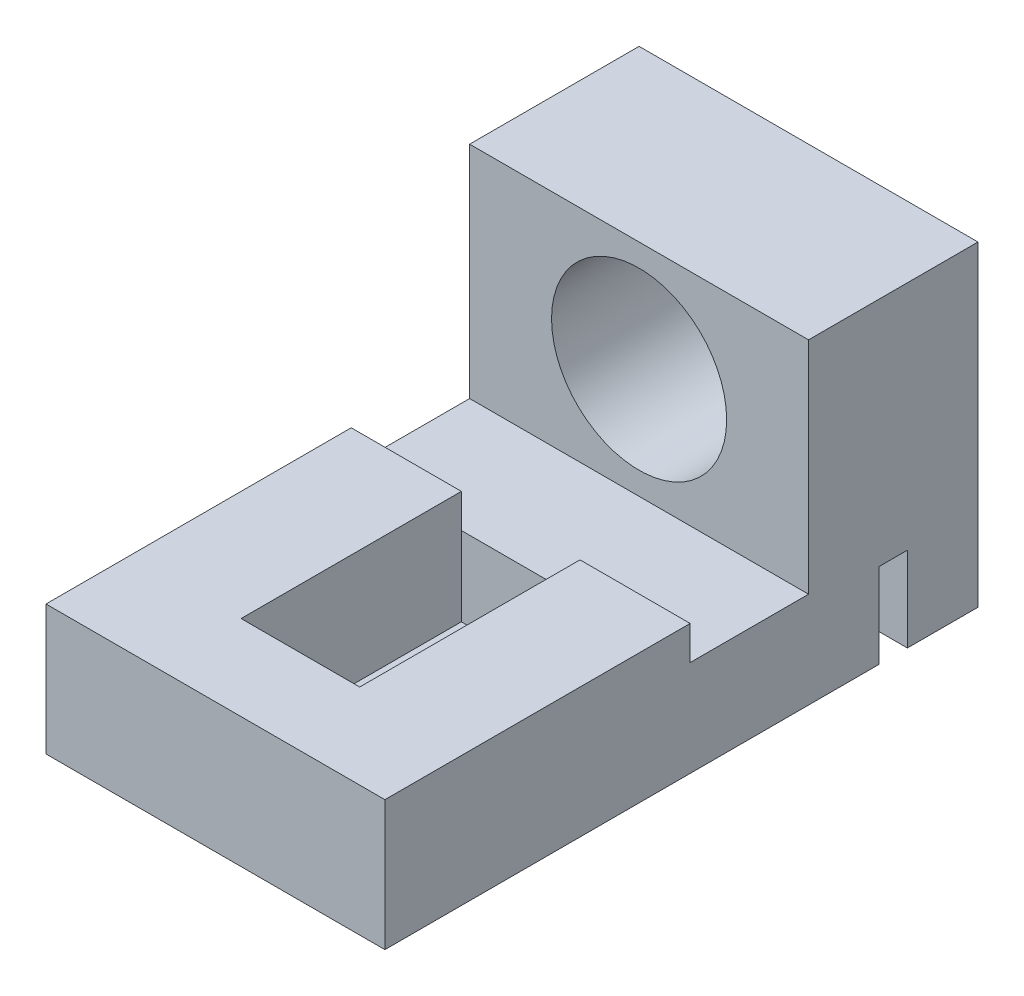
from build123d import *

# Parameters (mm, degrees)
EXTRUDE_1_DEPTH          = 60
CUT_EXTRUDE_1_DEPTH      = 40
CUT_EXTRUDE_1_DEPTH_BACK = 29
SKETCH_4_R               = 15.5
SKETCH_5_W               = 5
SKETCH_5_H               = 30
CUT_EXTRUDE_2_DEPTH      = 83.900874001
SKETCH_7_W               = 60
SKETCH_7_H               = 85.424918669
EXTRUDE_2_DEPTH          = 17
CUT_EXTRUDE_START        = -34.454396
SKETCH_9_W               = 21
SKETCH_9_H               = 39
CUT_EXTRUDE_3_DEPTH      = 14
CUT_EXTRUDE_START_2      = -15
SKETCH_14_W              = 60
SKETCH_14_H              = 56
CUT_EXTRUDE_8_DEPTH      = 10
CUT_EXTRUDE_START_3      = 15
SKETCH_16_W              = 60
SKETCH_16_H              = 39
CUT_EXTRUDE_11_DEPTH     = 10
EXTRUDE_START            = -34.454396
EXTRUDE_5_DEPTH          = 6


with BuildPart() as part:
    # 스케치3 → 보스-돌출1 (new body)
    with BuildSketch(Plane(origin=(0, 0, 0), x_dir=(0, 0, -1), z_dir=(1, 0, 0))):
        Polygon((-25, -51.454396413), (25, -51.454396413), (15, 4.545603587), (-15, 4.545603587), align=None)
    extrude(amount=EXTRUDE_1_DEPTH)

    # 스케치4 → 컷-돌출1 (cut, two sides: drawn at the far end of the back side and taken through both)
    with BuildSketch(Plane.XY.offset(-CUT_EXTRUDE_1_DEPTH_BACK)):
        with Locations(Location((30, -14.954396413, 0), (0, 0, 90))):
            Circle(SKETCH_4_R)
    extrude(amount=CUT_EXTRUDE_1_DEPTH + CUT_EXTRUDE_1_DEPTH_BACK, mode=Mode.SUBTRACT)

    # 스케치5 → 컷-돌출2 (cut, through all)
    with BuildSketch(Plane(origin=(0, 0, 0), x_dir=(0, 0, -1), z_dir=(1, 0, 0))):
        with Locations((0, -51.454396413)):
            Rectangle(SKETCH_5_W, SKETCH_5_H)
    extrude(amount=CUT_EXTRUDE_2_DEPTH, mode=Mode.SUBTRACT)

    # 스케치7 → 보스-돌출2 (add)
    with BuildSketch(Plane(origin=(0, -51.454396413, 0), x_dir=(-1, 0, 0), z_dir=(0, -1, 0))):
        with Locations((-30, -47.287540666)):
            Rectangle(SKETCH_7_W, SKETCH_7_H)
    extrude(amount=-EXTRUDE_2_DEPTH)

    # 스케치9 → 컷-돌출3 (cut)
    with BuildSketch(Plane(origin=(0, 0, 0), x_dir=(1, 0, 0), z_dir=(0, 1, 0)).offset(CUT_EXTRUDE_START)):
        with Locations((30, -55.464285714)):
            Rectangle(SKETCH_9_W, SKETCH_9_H)
    extrude(amount=-CUT_EXTRUDE_3_DEPTH, mode=Mode.SUBTRACT)

    # 스케치14 → 컷-돌출8 (cut)
    with BuildSketch(Plane.XY.offset(CUT_EXTRUDE_START_2)):
        with Locations((30, -23.454396413)):
            Rectangle(SKETCH_14_W, SKETCH_14_H)
    extrude(amount=-CUT_EXTRUDE_8_DEPTH, mode=Mode.SUBTRACT)

    # 스케치16 → 컷-돌출11 (cut)
    with BuildSketch(Plane.XY.offset(CUT_EXTRUDE_START_3)):
        with Locations((30, -14.954396413)):
            Rectangle(SKETCH_16_W, SKETCH_16_H)
    extrude(amount=CUT_EXTRUDE_11_DEPTH, mode=Mode.SUBTRACT)


with BuildPart() as extrude_5_tool:
    # 스케치17 → 보스-돌출5 (new body)
    with BuildSketch(Plane(origin=(0, 0, 0), x_dir=(1, 0, 0), z_dir=(0, 1, 0)).offset(EXTRUDE_START)):
        Polygon((19.5, -35.964285714), (0, -35.964285714), (0, -90), (60, -90), (60, -35.964285714), (40.5, -35.964285714), (40.5, -74.964285714), (19.5, -74.964285714), align=None)
    extrude(amount=EXTRUDE_5_DEPTH)


with BuildPart() as part_1:
    add(part.part)


with BuildPart() as part_2:
    # 보스-돌출5: joined with extrude_5_tool
    add(part_1.part.fuse(extrude_5_tool.part, tol=0.00001))


solid = part_2.part
